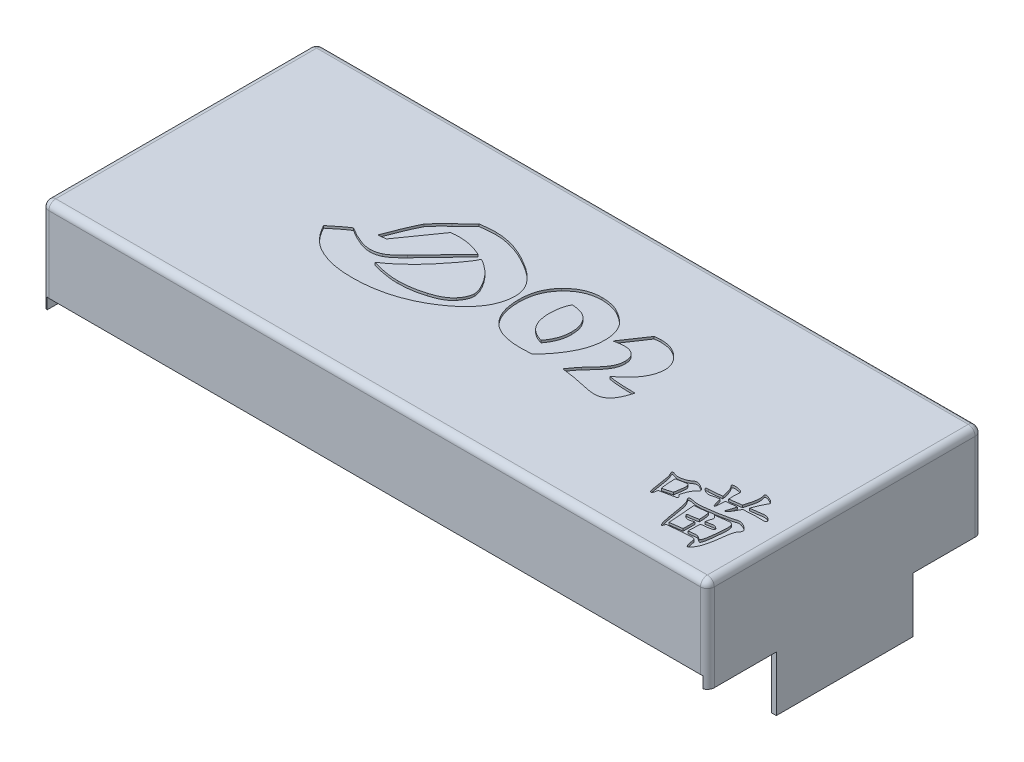
from build123d import *

# Parameters (mm, degrees)
SKETCH1_W               = 289.5
SKETCH1_H               = 119.5
BOSS_EXTRUDE1_DEPTH     = 65
SHELL1_T                = -2
CUT_EXTRUDE1_DEPTH      = 170.551245941
CUT_EXTRUDE1_DEPTH_BACK = 170.551245941
SKETCH2_W               = 285.5
SKETCH2_H               = 29
CUT_EXTRUDE3_DEPTH      = 170.551245941
CUT_EXTRUDE3_DEPTH_BACK = 170.551245941
SKETCH3_W               = 30
SKETCH3_H               = 24
CUT_EXTRUDE4_DEPTH      = 170.551245941
CUT_EXTRUDE5_DEPTH      = 1
CUT_EXTRUDE6_DEPTH      = 1
FILLET1_R               = 3
FILLET2_R               = 3
FILLET3_R               = 3
FILLET4_R               = 3


with BuildPart() as part:
    # Sketch1 → Boss-Extrude1 (new body)
    with BuildSketch(Plane(origin=(0, 0, 0), x_dir=(1, 0, 0), z_dir=(0, 1, 0))):
        Rectangle(SKETCH1_W, SKETCH1_H)
    extrude(amount=BOSS_EXTRUDE1_DEPTH)

    # Shell1
    shell1_openings = [part.faces().sort_by_distance(p)[0] for p in [
        (0, 0, 0),
    ]]
    offset(amount=SHELL1_T, openings=shell1_openings, kind=Kind.INTERSECTION)

    # Sketch2 → Cut-Extrude1 (cut, two sides: drawn at the far end of the back side and taken through both)
    with BuildSketch(Plane.XY.offset(-CUT_EXTRUDE1_DEPTH_BACK)):
        with Locations((0, 14.5)):
            Rectangle(SKETCH2_W, SKETCH2_H)
    extrude(amount=CUT_EXTRUDE1_DEPTH + CUT_EXTRUDE1_DEPTH_BACK, mode=Mode.SUBTRACT)

    # Sketch3 → Cut-Extrude3 (cut, two sides: drawn at the far end of the back side and taken through both)
    with BuildSketch(Plane(origin=(0, 0, 0), x_dir=(0, 0, -1), z_dir=(1, 0, 0)).offset(-CUT_EXTRUDE3_DEPTH_BACK)):
        with Locations((-44.75, 12)):
            Rectangle(SKETCH3_W, SKETCH3_H)
        with Locations((44.75, 12)):
            Rectangle(SKETCH3_W, SKETCH3_H)
    extrude(amount=CUT_EXTRUDE3_DEPTH + CUT_EXTRUDE3_DEPTH_BACK, mode=Mode.SUBTRACT)

    # Sketch4 → Cut-Extrude4 (cut, through all)
    with BuildSketch(Plane(origin=(0, 0, 0), x_dir=(0, 0, -1), z_dir=(1, 0, 0))):
        with BuildLine():
            Line((-5, 0), (5, 0))
            Line((5, 0), (5, 29))
            ThreePointArc((5, 29), (0, 34), (-5, 29))
            Line((-5, 29), (-5, 0))
        make_face()
    extrude(amount=-CUT_EXTRUDE4_DEPTH, mode=Mode.SUBTRACT)

    # Sketch7 → Cut-Extrude5 (cut)
    # profile 1 of 3: a face of its own
    with BuildSketch(Plane(origin=(0, 65, 0), x_dir=(1, 0, 0), z_dir=(0, 1, 0))):
        with BuildLine():
            Line((-54.674937259, 0.016499025), (-58.033506846, -0.321774171))
            add(Edge.make_bspline(
                [(-58.033506846, -0.321774171), (-57.747513462, 0.449210473), (-57.192568901, 1.945237155), (-56.366608965, 4.10798729), (-55.567478005, 6.11560535), (-54.807139042, 7.967661327), (-54.067679057, 9.660579734), (-53.384619826, 11.20871225), (-52.713951937, 12.59378829), (-52.26833461, 13.459636484), (-52.057347053, 13.869591809)],
                knots=[0, 0, 0, 0, 1.280833124, 2.485342015, 3.605857173, 4.646453942, 5.603507755, 6.483249438, 7.281860292, 8, 8, 8, 8], degree=3))
            add(Edge.make_bspline(
                [(-52.057347053, 13.869591809), (-51.654046154, 14.367633044), (-50.838006828, 15.375370036), (-49.728910948, 16.590023376), (-48.769263186, 17.583125645), (-47.965460337, 18.374271528), (-47.093068542, 19.217717275), (-46.479655133, 19.785200008), (-46.161728496, 20.07932119)],
                knots=[0, 0, 0, 0, 1.345467335, 2.722419564, 3.452015842, 4.245305386, 5.090557609, 6, 6, 6, 6], degree=3))
            add(Edge.make_bspline(
                [(-46.161728496, 20.07932119), (-45.811830686, 20.400535547), (-45.138737344, 21.018450946), (-44.185970858, 21.921240372), (-43.310823246, 22.742530058), (-42.527753894, 23.498003261), (-41.841446898, 24.194359353), (-41.22225591, 24.799702931), (-40.708430813, 25.35171183), (-40.394729077, 25.695513703), (-40.250001692, 25.854127891)],
                knots=[0, 0, 0, 0, 1.378904764, 2.65257909, 3.810405872, 4.863177172, 5.81110561, 6.648809811, 7.376623712, 8, 8, 8, 8], degree=3))
            add(Edge.make_bspline(
                [(-40.250001692, 25.854127891), (-39.890290388, 25.900037941), (-39.192663222, 25.989076282), (-38.178524945, 26.114001926), (-37.229533588, 26.204237894), (-36.352687359, 26.298216949), (-35.544424847, 26.364796084), (-34.805432136, 26.398866016), (-34.134645986, 26.4392313), (-33.710107974, 26.441162655), (-33.508700145, 26.442078922)],
                knots=[0, 0, 0, 0, 1.285372494, 2.492862357, 3.621548643, 4.664067405, 5.61871346, 6.495482762, 7.286232232, 8, 8, 8, 8], degree=3))
            add(Edge.make_bspline(
                [(-33.508700145, 26.442078922), (-32.791091018, 26.424787251), (-31.345694816, 26.389958659), (-29.169698963, 26.111394959), (-26.977169338, 25.665810789), (-24.762331238, 25.053949346), (-22.534149204, 24.248643752), (-20.287086942, 23.266599735), (-18.006714026, 22.129691135), (-16.522317377, 21.241134112), (-15.765465609, 20.788084077)],
                knots=[0, 0, 0, 0, 0.912968149, 1.838885047, 2.786969122, 3.758421451, 4.760189679, 5.799163767, 6.877856, 8, 8, 8, 8], degree=3))
            add(Edge.make_bspline(
                [(-15.765465609, 20.788084077), (-15.333769336, 20.533833058), (-14.48753116, 20.035434226), (-13.279570288, 19.243599226), (-12.150271401, 18.441941336), (-11.109233199, 17.617109846), (-10.147933191, 16.782970915), (-9.278677272, 15.925888815), (-8.483776814, 15.063942316), (-7.773718704, 14.184117759), (-7.141284414, 13.291378018), (-6.601322997, 12.376347603), (-6.13716503, 11.450166203), (-5.769070515, 10.504833989), (-5.473450737, 9.54726948), (-5.267957234, 8.574029648), (-5.130413671, 7.585923312), (-5.116730672, 6.922029364), (-5.109859939, 6.588663974)],
                knots=[0, 0, 0, 0, 1.29117103, 2.531034628, 3.721564212, 4.859552596, 5.953167633, 7.000325302, 8.004366033, 8.973757448, 9.912534029, 10.821587791, 11.709753225, 12.579697804, 13.433390691, 14.289799631, 15.141245953, 16, 16, 16, 16], degree=3))
            add(Edge.make_bspline(
                [(-5.109859939, 6.588663974), (-5.117606386, 6.129049388), (-5.133057359, 5.212307362), (-5.30572888, 3.848285785), (-5.55939586, 2.498603343), (-5.924190163, 1.165769406), (-6.393848443, -0.146202492), (-6.957535651, -1.444263984), (-7.640548987, -2.71461505), (-8.414561965, -3.97543053), (-9.293157924, -5.21670425), (-10.28437733, -6.434577881), (-11.368123568, -7.643845433), (-12.566500249, -8.824479082), (-13.85690843, -9.999210392), (-15.261256578, -11.143522562), (-16.75683574, -12.286154284), (-17.813016729, -13.003945132), (-18.350839321, -13.369454583)],
                knots=[0, 0, 0, 0, 0.88254379, 1.760311809, 2.63735212, 3.519488863, 4.411865311, 5.312653943, 6.23561556, 7.180398806, 8.153548558, 9.154832466, 10.19571932, 11.271645537, 12.3853819, 13.547055192, 14.750925126, 16, 16, 16, 16], degree=3))
            add(Edge.make_bspline(
                [(-18.350839321, -13.369454583), (-18.889911308, -13.723700183), (-19.965118561, -14.430261547), (-21.630403862, -15.393225264), (-23.301223693, -16.324012581), (-25.017701392, -17.155335668), (-26.750186604, -17.937710316), (-28.511374818, -18.651125362), (-30.302091587, -19.281360983), (-32.112090984, -19.866550569), (-33.950356935, -20.373208263), (-35.815625704, -20.807965286), (-37.707122987, -21.177068127), (-39.62449456, -21.485846621), (-41.567558103, -21.716803), (-43.536461472, -21.885244916), (-45.53224711, -21.995302643), (-46.873032156, -22.006101032), (-47.547037774, -22.011529325)],
                knots=[0, 0, 0, 0, 1.001564994, 1.997673725, 2.986627611, 3.971177121, 4.958415637, 5.938611922, 6.921084553, 7.906066562, 8.892318491, 9.881421781, 10.879831521, 11.884723522, 12.896803696, 13.917904333, 14.953341416, 16, 16, 16, 16], degree=3))
            add(Edge.make_bspline(
                [(-47.547037774, -22.011529325), (-48.113624292, -22.007790036), (-49.231284714, -22.000413835), (-50.877678403, -21.915248786), (-52.471268864, -21.790713246), (-54.004770709, -21.603429265), (-55.48383969, -21.374211468), (-56.903595907, -21.078922385), (-58.272390256, -20.750656541), (-59.154437802, -20.472823116), (-59.587952723, -20.336271593)],
                knots=[0, 0, 0, 0, 1.113876873, 2.197256828, 3.240546129, 4.256023808, 5.23404382, 6.182295846, 7.106622002, 8, 8, 8, 8], degree=3))
            add(Edge.make_bspline(
                [(-59.587952723, -20.336271593), (-60.011315145, -20.199163015), (-60.841745076, -19.930223066), (-62.035017318, -19.4452845), (-63.174195884, -18.940821244), (-64.252700988, -18.397706369), (-65.261244012, -17.803014931), (-66.217558965, -17.187296563), (-67.103004464, -16.518818826), (-67.652834734, -16.038605831), (-67.923970764, -15.801799944)],
                knots=[0, 0, 0, 0, 1.116558819, 2.1901421, 3.230760133, 4.243292989, 5.218688215, 6.168112262, 7.0966471, 8, 8, 8, 8], degree=3))
            add(Edge.make_bspline(
                [(-67.923970764, -15.801799944), (-68.162523441, -15.586782605), (-68.649312866, -15.148019277), (-69.353520889, -14.426568535), (-70.04090305, -13.628248857), (-70.730597795, -12.761715255), (-71.410031525, -11.82176341), (-72.088468239, -10.812689491), (-72.757956788, -9.732942977), (-73.183327774, -8.978848054), (-73.400774888, -8.593359222)],
                knots=[0, 0, 0, 0, 0.84709784, 1.728583703, 2.657370405, 3.625220998, 4.649476239, 5.716123303, 6.832495838, 8, 8, 8, 8], degree=3))
            add(Edge.make_bspline(
                [(-73.400774888, -8.593359222), (-72.978901127, -8.247502103), (-72.170505248, -7.58476956), (-71.016222893, -6.626186257), (-69.939676232, -5.788490286), (-68.978431401, -5.022958057), (-68.099274573, -4.372472493), (-67.319216278, -3.818766327), (-66.642917592, -3.350281634), (-66.212323803, -3.090528669), (-66.015143444, -2.971580872)],
                knots=[0, 0, 0, 0, 1.409436766, 2.700767341, 3.876124895, 4.933438545, 5.875387055, 6.701060049, 7.405180815, 8, 8, 8, 8], degree=3))
            add(Edge.make_bspline(
                [(-66.015143444, -2.971580872), (-65.43284187, -3.325714975), (-64.307482491, -4.010116585), (-62.631305819, -4.917243563), (-61.04537923, -5.700181203), (-59.537469284, -6.327519278), (-58.117871853, -6.830130817), (-56.778267635, -7.17545883), (-55.522865687, -7.401773427), (-54.710685854, -7.434130809), (-54.320555815, -7.449673655)],
                knots=[0, 0, 0, 0, 1.291298086, 2.495570122, 3.610471241, 4.641272912, 5.588924353, 6.461319531, 7.260895866, 8, 8, 8, 8], degree=3))
            add(Edge.make_bspline(
                [(-54.320555815, -7.449673655), (-53.954536521, -7.437299413), (-53.217483735, -7.412381409), (-52.113614924, -7.206144994), (-51.00621516, -6.890668703), (-50.293019175, -6.577622722), (-49.931058393, -6.41874582)],
                knots=[0, 0, 0, 0, 0.965975582, 1.945184323, 2.957141225, 4, 4, 4, 4], degree=3))
            add(Edge.make_bspline(
                [(-49.931058393, -6.41874582), (-49.735844474, -6.32009323), (-49.321782833, -6.110844556), (-48.701493571, -5.703913613), (-48.022315271, -5.22042972), (-47.294495383, -4.641673441), (-46.520861758, -3.969523209), (-45.699996412, -3.208304886), (-44.819189716, -2.365120395), (-44.229438356, -1.757400081), (-43.922682104, -1.441297367)],
                knots=[0, 0, 0, 0, 0.669398079, 1.419837625, 2.268608205, 3.222713685, 4.266168329, 5.406669527, 6.651091983, 8, 8, 8, 8], degree=3))
            add(Edge.make_bspline(
                [(-43.922682104, -1.441297367), (-43.753678156, -1.266662837), (-43.397189743, -0.89829756), (-42.830594611, -0.318432161), (-42.213686716, 0.326362703), (-41.5339295, 1.026664466), (-40.803997937, 1.791999518), (-40.011784986, 2.615991653), (-39.15838565, 3.499687764), (-38.25098197, 4.447428678), (-37.289776436, 5.45936207), (-36.269422447, 6.527721455), (-35.18744378, 7.655379125), (-34.05501605, 8.847762597), (-32.859703985, 10.095688918), (-31.612077721, 11.411795327), (-30.301279519, 12.783181674), (-29.411509118, 13.721621935), (-28.958120248, 14.199810881)],
                knots=[0, 0, 0, 0, 0.538878973, 1.136684156, 1.797692869, 2.5176244, 3.300768368, 4.142832361, 5.052235536, 6.024852748, 7.052275906, 8.147031612, 9.300705128, 10.517601121, 11.793413326, 13.132450907, 14.538819856, 16, 16, 16, 16], degree=3))
            add(Edge.make_bspline(
                [(-28.958120248, 14.199810881), (-29.393967221, 14.394553366), (-30.257329253, 14.780315523), (-31.573300011, 15.282190878), (-32.892968661, 15.696465274), (-34.210680002, 16.049890676), (-35.535038576, 16.312678082), (-36.859915522, 16.507746634), (-38.188787449, 16.622982665), (-39.073884533, 16.639829051), (-39.517076434, 16.648264489)],
                knots=[0, 0, 0, 0, 1.048530823, 2.077017297, 3.091663908, 4.08584548, 5.072423895, 6.055753608, 7.026463571, 8, 8, 8, 8], degree=3))
            add(Edge.make_bspline(
                [(-39.517076434, 16.648264489), (-39.766817882, 16.647786981), (-40.298828672, 16.646769771), (-41.141519558, 16.597482315), (-42.079358563, 16.547665907), (-42.733525744, 16.486880937), (-43.076999114, 16.45496552)],
                knots=[0, 0, 0, 0, 0.840143385, 1.789712318, 2.839478681, 4, 4, 4, 4], degree=3))
            add(Edge.make_bspline(
                [(-43.076999114, 16.45496552), (-43.112257271, 16.412287547), (-43.213532805, 16.28969933), (-43.3952682, 16.035197032), (-43.668813506, 15.669244974), (-44.02673686, 15.183121115), (-44.455957163, 14.57228368), (-44.976162718, 13.84351089), (-45.576944995, 12.996605112), (-46.252638304, 12.021149456), (-47.030175005, 10.942584931), (-47.869176019, 9.728658262), (-48.811482492, 8.409952014), (-49.818910394, 6.960383104), (-50.921130573, 5.397310875), (-52.089966611, 3.70450471), (-53.359099943, 1.902810396), (-54.22709703, 0.65849793), (-54.674937259, 0.016499025)],
                knots=[0, 0, 0, 0, 0.132047228, 0.379292478, 0.745680671, 1.222257434, 1.819422896, 2.526787836, 3.358506575, 4.296736332, 5.357783742, 6.530570938, 7.817241471, 9.224586106, 10.742125874, 12.380363193, 14.132460352, 16, 16, 16, 16], degree=3))
        make_face()
        with BuildLine():
            add(Edge.make_bspline(
                [(-48.416883135, -11.267328294), (-47.878244243, -11.426573626), (-46.818793538, -11.73979382), (-45.236368656, -12.142044335), (-43.689445329, -12.482460098), (-42.176145217, -12.754398812), (-40.698943959, -12.972734093), (-39.257161694, -13.139370242), (-37.845606501, -13.22665756), (-36.915695166, -13.241375218), (-36.456509424, -13.248642727)],
                knots=[0, 0, 0, 0, 1.107941863, 2.179214694, 3.220104169, 4.23191643, 5.211588704, 6.165483813, 7.094124734, 8, 8, 8, 8], degree=3))
            add(Edge.make_bspline(
                [(-36.456509424, -13.248642727), (-35.534539888, -13.230045538), (-33.676702079, -13.192570806), (-30.885376889, -12.835253483), (-28.063913126, -12.323623092), (-26.20790434, -11.793261167), (-25.269331589, -11.525060253)],
                knots=[0, 0, 0, 0, 0.973595114, 1.961867225, 2.969328216, 4, 4, 4, 4], degree=3))
            add(Edge.make_bspline(
                [(-25.269331589, -11.525060253), (-24.813805662, -11.382634711), (-23.929881281, -11.106265349), (-22.674138666, -10.618371991), (-21.51242606, -10.107696998), (-20.464453309, -9.543090628), (-19.506535543, -8.956591173), (-18.664491014, -8.315314301), (-17.902351648, -7.656214388), (-17.47811982, -7.159783814), (-17.271586743, -6.91810149)],
                knots=[0, 0, 0, 0, 1.223283248, 2.373717554, 3.45207125, 4.474404087, 5.423613715, 6.32804501, 7.186025221, 8, 8, 8, 8], degree=3))
            add(Edge.make_bspline(
                [(-17.271586743, -6.91810149), (-17.083663061, -6.67849858), (-16.719246472, -6.213867013), (-16.233876263, -5.505949466), (-15.826958075, -4.804930691), (-15.488697983, -4.120285254), (-15.227131778, -3.443715393), (-15.038371978, -2.783995452), (-14.931763439, -2.132014762), (-14.912963414, -1.702061082), (-14.903674372, -1.489622109)],
                knots=[0, 0, 0, 0, 1.210590801, 2.347545365, 3.409460581, 4.43112375, 5.380701617, 6.289816649, 7.155002944, 8, 8, 8, 8], degree=3))
            add(Edge.make_bspline(
                [(-14.903674372, -1.489622109), (-14.913768208, -1.25270003), (-14.934926984, -0.756062184), (-15.092453548, 0.009023507), (-15.326983716, 0.828359945), (-15.660986329, 1.697380479), (-16.090883954, 2.616512256), (-16.61957865, 3.584772176), (-17.241022361, 4.606554355), (-17.701202747, 5.296328778), (-17.940079011, 5.654385623)],
                knots=[0, 0, 0, 0, 0.722601917, 1.514723581, 2.375584877, 3.321971516, 4.351898795, 5.46993908, 6.686663928, 8, 8, 8, 8], degree=3))
            add(Edge.make_bspline(
                [(-17.940079011, 5.654385623), (-18.204616507, 6.019792324), (-18.735275388, 6.752793559), (-19.604636592, 7.801085664), (-20.554628627, 8.793401092), (-21.565240343, 9.743563682), (-22.652654754, 10.640185671), (-23.803379101, 11.49199313), (-25.02110898, 12.303568612), (-25.875781007, 12.792552189), (-26.308313547, 13.040017066)],
                knots=[0, 0, 0, 0, 0.961333478, 1.928422835, 2.899802505, 3.887593865, 4.883259486, 5.901813225, 6.938149341, 8, 8, 8, 8], degree=3))
            add(Edge.make_bspline(
                [(-26.308313547, 13.040017066), (-26.387396593, 12.872826154), (-26.552255889, 12.524294102), (-26.841601188, 11.990991213), (-27.158533472, 11.407477238), (-27.542024043, 10.793085875), (-27.957179746, 10.132945216), (-28.421706605, 9.436547345), (-28.926612103, 8.696400613), (-29.676548981, 7.64787073), (-30.676907677, 6.282910088), (-31.972080511, 4.621755422), (-33.335857577, 2.891854674), (-34.297812266, 1.740430212), (-34.789305815, 1.152130468)],
                knots=[0, 0, 0, 0, 0.454872032, 0.948242222, 1.492193265, 2.087959296, 2.729208267, 3.410588809, 4.146973686, 4.933117171, 6.581576909, 8.309404673, 10.1143563, 12, 12, 12, 12], degree=3))
            add(Edge.make_bspline(
                [(-34.789305815, 1.152130468), (-35.250057639, 0.606592854), (-36.187794712, -0.503703015), (-37.693326946, -2.141542107), (-39.311492271, -3.786779437), (-41.018072674, -5.435372017), (-42.799505215, -7.034000224), (-44.627599842, -8.552158103), (-46.496379294, -9.964863273), (-47.779516885, -10.835073368), (-48.416883135, -11.267328294)],
                knots=[0, 0, 0, 0, 0.926221979, 1.885077049, 2.884930053, 3.919398158, 4.962605073, 5.989075526, 7.001123964, 8, 8, 8, 8], degree=3))
        make_face(mode=Mode.SUBTRACT)
    # profile 2 of 3: a face of its own
    with BuildSketch(Plane(origin=(0, 65, 0), x_dir=(1, 0, 0), z_dir=(0, 1, 0))):
        with BuildLine():
            add(Edge.make_bspline(
                [(20.445874597, -11.678088604), (20.145200215, -11.691784528), (19.568079692, -11.718072763), (18.73584401, -11.751632035), (17.975856912, -11.772099562), (17.288787145, -11.800395914), (16.676483529, -11.812935798), (16.137010873, -11.831843431), (15.669808915, -11.840582103), (15.382517543, -11.83961426), (15.250964803, -11.839171078)],
                knots=[0, 0, 0, 0, 1.38976758, 2.667548158, 3.845782986, 4.900123914, 5.842568302, 6.673489852, 7.39258167, 8, 8, 8, 8], degree=3))
            add(Edge.make_bspline(
                [(15.250964803, -11.839171078), (14.493373087, -11.825934825), (13.025880976, -11.800295557), (10.899928484, -11.584141521), (8.931178162, -11.21444571), (7.112094579, -10.713223571), (5.452033975, -10.053447914), (3.950182462, -9.242159982), (2.591976146, -8.294907684), (1.815202332, -7.535987456), (1.430088514, -7.159725202)],
                knots=[0, 0, 0, 0, 1.211870576, 2.347452425, 3.41394946, 4.413409066, 5.361759666, 6.265034661, 7.139827948, 8, 8, 8, 8], degree=3))
            add(Edge.make_bspline(
                [(1.430088514, -7.159725202), (1.070699941, -6.759894196), (0.347507419, -5.955319942), (-0.556233177, -4.58605858), (-1.336444986, -3.106964282), (-1.961415262, -1.499922839), (-2.455159554, 0.222369511), (-2.794116114, 2.067546931), (-3.008119609, 4.033151014), (-3.034451933, 5.385332926), (-3.048004269, 6.08125418)],
                knots=[0, 0, 0, 0, 0.899394148, 1.809838066, 2.739099067, 3.696050547, 4.692361407, 5.735693675, 6.834639863, 8, 8, 8, 8], degree=3))
            add(Edge.make_bspline(
                [(-3.048004269, 6.08125418), (-3.03346585, 6.747888828), (-3.004934367, 8.056151844), (-2.753124217, 9.971429462), (-2.368445567, 11.80065927), (-1.797969045, 13.530384993), (-1.079828396, 15.170493896), (-0.196964661, 16.71412352), (0.843994717, 18.170700635), (1.656525908, 19.048573586), (2.066364288, 19.491370159)],
                knots=[0, 0, 0, 0, 1.085421029, 2.13012659, 3.141420271, 4.126067407, 5.09138384, 6.053097759, 7.017988149, 8, 8, 8, 8], degree=3))
            add(Edge.make_bspline(
                [(2.066364288, 19.491370159), (2.490810413, 19.921231626), (3.325880558, 20.766956102), (4.69300056, 21.872728815), (6.127633579, 22.809831499), (7.633023029, 23.564361663), (9.196526749, 24.173901319), (10.834281643, 24.583225457), (12.532945854, 24.855888938), (13.690059941, 24.882302409), (14.276415834, 24.895687169)],
                knots=[0, 0, 0, 0, 1.053382021, 2.07246061, 3.061202137, 4.03741458, 5.005648873, 5.982715062, 6.977761203, 8, 8, 8, 8], degree=3))
            add(Edge.make_bspline(
                [(14.276415834, 24.895687169), (14.690113822, 24.890452737), (15.505463159, 24.880136296), (16.704598663, 24.770230766), (17.86486174, 24.604554198), (18.980571407, 24.361247028), (20.056925773, 24.059568368), (21.083783298, 23.672649004), (22.078282627, 23.239320357), (22.703924897, 22.882473134), (23.015140061, 22.70496552)],
                knots=[0, 0, 0, 0, 1.088524132, 2.145351092, 3.166620004, 4.171402837, 5.14878054, 6.105637182, 7.057681263, 8, 8, 8, 8], degree=3))
            add(Edge.make_bspline(
                [(23.015140061, 22.70496552), (23.336571175, 22.514772398), (23.966304719, 22.142154494), (24.860637419, 21.540726633), (25.7016576, 20.935428525), (26.466408657, 20.295150365), (27.169527743, 19.643153863), (27.80964074, 18.973004281), (28.384037222, 18.281774335), (28.720759399, 17.797089461), (28.886596246, 17.558380468)],
                knots=[0, 0, 0, 0, 1.137649211, 2.228831737, 3.28242594, 4.293043015, 5.265331369, 6.202583347, 7.114766023, 8, 8, 8, 8], degree=3))
            add(Edge.make_bspline(
                [(28.886596246, 17.558380468), (29.05650334, 17.287901812), (29.400353378, 16.740519741), (29.808655445, 15.845021895), (30.180206728, 14.902324896), (30.460889938, 13.890617484), (30.700571096, 12.827557359), (30.856171189, 11.701394713), (30.955312312, 10.518199629), (30.966763882, 9.708507149), (30.972614288, 9.294849541)],
                knots=[0, 0, 0, 0, 0.886039969, 1.793126302, 2.727676125, 3.697453612, 4.705008985, 5.751953224, 6.851512547, 8, 8, 8, 8], degree=3))
            add(Edge.make_bspline(
                [(30.972614288, 9.294849541), (30.964678931, 8.873090499), (30.948776121, 8.027866541), (30.825023885, 6.757431042), (30.612962048, 5.483238443), (30.32226561, 4.200512469), (29.950170016, 2.910104974), (29.498809243, 1.614100657), (28.966001324, 0.311735688), (28.339892978, -0.993568818), (27.642445945, -2.312414376), (26.859544199, -3.634296402), (25.991208988, -4.957695506), (25.05079461, -6.296639301), (24.019724663, -7.638529044), (22.904313521, -8.984193476), (21.713255174, -10.33940167), (20.872926014, -11.227010086), (20.445874597, -11.678088604)],
                knots=[0, 0, 0, 0, 0.841784231, 1.686973201, 2.545077378, 3.418720343, 4.310887603, 5.224383061, 6.156858553, 7.118087377, 8.112966109, 9.134056587, 10.183442855, 11.271788038, 12.399376132, 13.560343902, 14.760177985, 16, 16, 16, 16], degree=3))
        make_face()
        with BuildLine():
            add(Edge.make_bspline(
                [(10.595681298, 15.617336654), (10.451248199, 15.351224503), (10.156887238, 14.808876323), (9.797273221, 13.930957662), (9.493360647, 12.990597011), (9.244387279, 11.980832697), (9.041276956, 10.908649992), (8.911720151, 9.764392624), (8.815899125, 8.558183233), (8.81045513, 7.729874794), (8.807665834, 7.305480984)],
                knots=[0, 0, 0, 0, 0.844831347, 1.721803168, 2.643869773, 3.601914824, 4.623640527, 5.688157834, 6.815499807, 8, 8, 8, 8], degree=3))
            add(Edge.make_bspline(
                [(8.807665834, 7.305480984), (8.813350584, 6.915958097), (8.824424956, 6.157134618), (8.925218362, 5.046472886), (9.078629221, 3.992259285), (9.319544062, 2.996285895), (9.603149865, 2.053837782), (9.958693123, 1.168190866), (10.387336539, 0.344243679), (10.881215563, -0.421538163), (11.429571789, -1.139227745), (12.054369756, -1.790699735), (12.738643127, -2.391058599), (13.497153038, -2.921031752), (14.308497208, -3.409556133), (15.195205233, -3.822557942), (16.135574809, -4.201226008), (16.79803131, -4.389704481), (17.135629752, -4.48575613)],
                knots=[0, 0, 0, 0, 1.188005534, 2.314335106, 3.399660332, 4.434654097, 5.437221659, 6.399924281, 7.341349857, 8.265988911, 9.176814061, 10.092120452, 11.015125834, 11.949112022, 12.91125708, 13.900353187, 14.929986358, 16, 16, 16, 16], degree=3))
            add(Edge.make_bspline(
                [(17.135629752, -4.48575613), (17.41855663, -4.106250186), (17.975990791, -3.358531985), (18.688373678, -2.179719063), (19.296404815, -0.989990145), (19.801920195, 0.208001021), (20.177618586, 1.429708936), (20.465981312, 2.657864648), (20.628281349, 3.907662824), (20.651629492, 4.743837377), (20.663335937, 5.163084077)],
                knots=[0, 0, 0, 0, 1.085155259, 2.138017475, 3.154174569, 4.14790209, 5.115807064, 6.082241965, 7.038461857, 8, 8, 8, 8], degree=3))
            add(Edge.make_bspline(
                [(20.663335937, 5.163084077), (20.658232621, 5.469250998), (20.648283018, 6.066164803), (20.584301391, 6.940305614), (20.474205644, 7.769435436), (20.309917601, 8.553786746), (20.112366622, 9.298568967), (19.860537149, 9.996926987), (19.57601998, 10.656227988), (19.338556684, 11.060850389), (19.221647793, 11.260055726)],
                knots=[0, 0, 0, 0, 1.158325379, 2.258311923, 3.314126806, 4.320103133, 5.28845556, 6.226557231, 7.126891478, 8, 8, 8, 8], degree=3))
            add(Edge.make_bspline(
                [(19.221647793, 11.260055726), (18.976702245, 11.632854513), (18.502916146, 12.353940831), (17.647401673, 13.279006847), (16.715196973, 14.036023133), (16.020525288, 14.388409155), (15.67783336, 14.562246448)],
                knots=[0, 0, 0, 0, 1.087279757, 2.103071642, 3.064216879, 4, 4, 4, 4], degree=3))
            add(Edge.make_bspline(
                [(15.67783336, 14.562246448), (15.294391535, 14.716846503), (14.514868345, 15.031142754), (13.266602356, 15.328393792), (11.956085517, 15.548933748), (11.055722086, 15.5942052), (10.595681298, 15.617336654)],
                knots=[0, 0, 0, 0, 0.949117954, 1.92952205, 2.942089078, 4, 4, 4, 4], degree=3))
        make_face(mode=Mode.SUBTRACT)
    # profile 3 of 3: a face of its own
    with BuildSketch(Plane(origin=(0, 65, 0), x_dir=(1, 0, 0), z_dir=(0, 1, 0))):
        with BuildLine():
            Line((33.042524081, 10.857349541), (40.259018927, 21.537117582))
            add(Edge.make_bspline(
                [(40.259018927, 21.537117582), (40.535468826, 21.575193812), (41.058337731, 21.647210032), (41.80366901, 21.742219506), (42.470532229, 21.791274381), (42.889972681, 21.799199511), (43.08601635, 21.802903664)],
                knots=[0, 0, 0, 0, 1.178383744, 2.228759059, 3.172133805, 4, 4, 4, 4], degree=3))
            add(Edge.make_bspline(
                [(43.08601635, 21.802903664), (43.502617857, 21.794230273), (44.319637919, 21.777220409), (45.517867983, 21.625449902), (46.666524371, 21.394806903), (47.764992377, 21.069191529), (48.801939168, 20.626170093), (49.787241893, 20.099827118), (50.733245607, 19.492450128), (51.303807169, 19.004301418), (51.591170989, 18.758444901)],
                knots=[0, 0, 0, 0, 1.081191072, 2.120383105, 3.130582158, 4.120670419, 5.089002386, 6.052530951, 7.019155542, 8, 8, 8, 8], degree=3))
            add(Edge.make_bspline(
                [(51.591170989, 18.758444901), (51.878135413, 18.489594439), (52.43747861, 17.96555848), (53.172184838, 17.114611509), (53.798150769, 16.242716399), (54.309529611, 15.344218962), (54.710356526, 14.418618469), (54.989934455, 13.466359017), (55.16825094, 12.488258042), (55.188962641, 11.827295364), (55.199418411, 11.493625314)],
                knots=[0, 0, 0, 0, 1.127361027, 2.197421238, 3.218906291, 4.201836329, 5.157445083, 6.105326584, 7.043522736, 8, 8, 8, 8], degree=3))
            add(Edge.make_bspline(
                [(55.199418411, 11.493625314), (55.189928964, 11.173967784), (55.170902028, 10.533034423), (55.070908017, 9.572141583), (54.869401472, 8.621788672), (54.612190402, 7.673938475), (54.285241285, 6.731574253), (53.866663622, 5.801648525), (53.38423326, 4.875588811), (52.827646508, 3.953422743), (52.185160117, 3.04458022), (51.480966144, 2.134152354), (50.691761914, 1.23960263), (49.839951798, 0.344855653), (48.908288055, -0.542709349), (47.905743626, -1.426818278), (46.821182586, -2.297252205), (46.065114518, -2.861134981), (45.679444185, -3.148771593)],
                knots=[0, 0, 0, 0, 0.846135376, 1.696554406, 2.55200292, 3.413711649, 4.294449799, 5.188157408, 6.109640586, 7.056301992, 8.035794083, 9.053270764, 10.100495129, 11.190855016, 12.321391551, 13.50428507, 14.726935773, 16, 16, 16, 16], degree=3))
            add(Edge.make_bspline(
                [(45.679444185, -3.148771593), (45.955421047, -3.20814628), (46.565935117, -3.339494545), (47.580760489, -3.482828465), (48.778034814, -3.622490069), (50.162021415, -3.728665161), (51.732753405, -3.824676941), (53.488669603, -3.905887621), (55.430078756, -3.959020712), (56.786057534, -3.982290953), (57.494843669, -3.994454583)],
                knots=[0, 0, 0, 0, 0.570975867, 1.263108792, 2.072287824, 3.009631731, 4.070818936, 5.256176973, 6.565771271, 8, 8, 8, 8], degree=3))
            Line((57.494843669, -3.994454583), (56.5202947, -6.901993243))
            add(Edge.make_bspline(
                [(56.5202947, -6.901993243), (56.405936475, -7.190905497), (56.184145096, -7.751234645), (55.798073178, -8.542490007), (55.410046668, -9.274940925), (54.994358825, -9.941217066), (54.565232768, -10.547070503), (54.101857933, -11.078498033), (53.628989334, -11.552059515), (53.287916424, -11.820779164), (53.121454494, -11.95192881)],
                knots=[0, 0, 0, 0, 1.209024934, 2.3448362, 3.424907327, 4.434045164, 5.399830109, 6.311160134, 7.175755286, 8, 8, 8, 8], degree=3))
            add(Edge.make_bspline(
                [(53.121454494, -11.95192881), (52.813052956, -12.150491021), (52.195082457, -12.54836708), (51.158258605, -12.95570494), (50.048640959, -13.205129669), (49.283682527, -13.233933442), (48.893039545, -13.248642727)],
                knots=[0, 0, 0, 0, 0.977685923, 1.959072779, 2.957755271, 4, 4, 4, 4], degree=3))
            add(Edge.make_bspline(
                [(48.893039545, -13.248642727), (48.756096545, -13.243869911), (48.457810524, -13.233473874), (47.973680328, -13.202784935), (47.420069273, -13.13739111), (46.796405168, -13.033147817), (46.098774851, -12.928184696), (45.329915646, -12.775931038), (44.488862628, -12.610451692), (43.904658863, -12.48445518), (43.601480267, -12.419067985)],
                knots=[0, 0, 0, 0, 0.61310789, 1.335457182, 2.169871408, 3.105998214, 4.164529677, 5.326020067, 6.612310411, 8, 8, 8, 8], degree=3))
            add(Edge.make_bspline(
                [(43.601480267, -12.419067985), (43.070166477, -12.299788615), (42.027673554, -12.065750083), (40.49532163, -11.742225638), (39.024758376, -11.465018582), (37.622852996, -11.199578087), (36.279041877, -10.98674012), (35.001845865, -10.797335562), (33.787156496, -10.654383845), (32.999664581, -10.573731828), (32.615655525, -10.534403037)],
                knots=[0, 0, 0, 0, 1.171656753, 2.298912423, 3.369507655, 4.391483015, 5.368693, 6.296723519, 7.16942183, 8, 8, 8, 8], degree=3))
            add(Edge.make_bspline(
                [(32.615655525, -10.534403037), (32.822741716, -10.239343518), (33.218088081, -9.676048074), (33.775589045, -8.869617712), (34.295742688, -8.15873534), (34.758288876, -7.536436983), (35.164762388, -6.998216031), (35.51604157, -6.547221952), (35.819885362, -6.184650533), (36.011151677, -5.977865238), (36.095036968, -5.887173655)],
                knots=[0, 0, 0, 0, 1.489268318, 2.843148608, 4.050025529, 5.128120633, 6.046500884, 6.836409323, 7.489674158, 8, 8, 8, 8], degree=3))
            add(Edge.make_bspline(
                [(36.095036968, -5.887173655), (36.439459322, -5.533555631), (37.103231554, -4.852061463), (38.05154999, -3.853197083), (38.900776061, -2.903700024), (39.668178235, -2.019343612), (40.342444647, -1.198279016), (40.928990662, -0.459285978), (41.411744426, 0.208016408), (41.686187825, 0.632913521), (41.813464803, 0.82996552)],
                knots=[0, 0, 0, 0, 1.340805125, 2.584005365, 3.740680074, 4.800554176, 5.764112574, 6.626253854, 7.362905945, 8, 8, 8, 8], degree=3))
            add(Edge.make_bspline(
                [(41.813464803, 0.82996552), (42.047795189, 1.235012581), (42.508393589, 2.031170654), (42.99332344, 3.308837791), (43.286309345, 4.62084224), (43.324575898, 5.507934752), (43.343748308, 5.9523882)],
                knots=[0, 0, 0, 0, 1.035576096, 2.035522161, 3.01575209, 4, 4, 4, 4], degree=3))
            add(Edge.make_bspline(
                [(43.343748308, 5.9523882), (43.326450957, 6.359677811), (43.293338532, 7.139354776), (43.006215831, 8.244567689), (42.524190386, 9.223110188), (42.049381076, 9.749915345), (41.813464803, 10.011666551)],
                knots=[0, 0, 0, 0, 1.095512209, 2.097145645, 3.054537687, 4, 4, 4, 4], degree=3))
            add(Edge.make_bspline(
                [(41.813464803, 10.011666551), (41.681553535, 10.129894644), (41.415923498, 10.367970837), (40.972553893, 10.676001302), (40.481555805, 10.923292496), (39.957489782, 11.136087648), (39.386636651, 11.293939114), (38.779051554, 11.417525912), (38.12856999, 11.47786554), (37.684476479, 11.48827446), (37.456183875, 11.493625314)],
                knots=[0, 0, 0, 0, 0.900209006, 1.812753034, 2.734642146, 3.690274843, 4.684046451, 5.741497964, 6.83898481, 8, 8, 8, 8], degree=3))
            add(Edge.make_bspline(
                [(37.456183875, 11.493625314), (37.163201387, 11.484777854), (36.526842281, 11.465561138), (35.498600151, 11.32880028), (34.316907284, 11.142871743), (33.484549107, 10.956384084), (33.042524081, 10.857349541)],
                knots=[0, 0, 0, 0, 0.786957638, 1.70927506, 2.783507177, 4, 4, 4, 4], degree=3))
        make_face()
    extrude(amount=-CUT_EXTRUDE5_DEPTH, mode=Mode.SUBTRACT)

    # Sketch6 → Cut-Extrude6 (cut)
    # profile 1 of 3: a face of its own
    with BuildSketch(Plane(origin=(0, 65, 0), x_dir=(1, 0, 0), z_dir=(0, 1, 0))):
        with BuildLine():
            add(Edge.make_bspline(
                [(113.738519479, -46.658187112), (113.697764889, -46.806392469), (113.623900313, -47.075003334), (113.489202061, -47.427633811), (113.375657242, -47.705741928), (113.249153547, -47.889801443), (113.135173358, -48.019293539), (112.988606059, -48.036010797), (112.856783839, -47.952553498), (112.709379192, -47.702552439), (112.520261928, -47.261804219), (112.290368225, -46.582097275), (112.049121551, -45.71794607), (111.838836944, -44.880863752), (111.673197258, -44.10961342), (111.538504509, -43.448656507), (111.391046794, -42.729003213), (111.261933986, -41.944569981), (111.105339852, -41.104361714), (110.968340154, -40.199426958), (110.817475209, -39.238001378), (110.664577871, -38.241563805), (110.521101942, -37.261906176), (110.35053545, -36.354126937), (110.170804506, -35.54077956), (109.977936884, -34.823061906), (109.777774713, -34.1990863), (109.566836489, -33.671471491), (109.342838894, -33.238165257), (109.10450434, -32.901980674), (108.876157995, -32.642939212), (108.723179871, -32.401332452), (108.614030035, -32.198940624), (108.552687955, -32.027626869), (108.554335569, -31.879198332), (108.620105126, -31.758428096), (108.751501566, -31.688315874), (109.00082165, -31.642003467), (109.390439519, -31.634458826), (109.934978359, -31.679292228), (110.578152764, -31.769101841), (111.173418703, -31.900280935), (111.712775174, -32.009102679), (112.178294536, -32.055079642), (112.68969769, -32.088117986), (113.246880724, -32.101688449), (113.851487163, -32.085781685), (114.503538183, -32.052468816), (115.201621155, -32.002850004), (116.206544229, -31.891183442), (117.531873412, -31.731101251), (119.180597095, -31.477035953), (120.911241782, -31.203451379), (122.377072577, -30.927667076), (123.535962014, -30.707189377), (124.328737196, -30.544672153), (125.037441949, -30.390240901), (125.66040077, -30.23921585), (126.200975275, -30.1051085), (126.654733471, -29.977816117), (127.022742804, -29.85388842), (127.403607647, -29.702417962), (127.847797266, -29.533673563), (128.42861676, -29.496337187), (129.056225622, -29.54744761), (129.719754382, -29.724988955), (130.404591972, -29.979249472), (131.077852683, -30.335014019), (131.727040491, -30.780186434), (132.238411101, -31.208054082), (132.605536098, -31.576633206), (132.805983987, -31.864271163), (132.928204562, -32.154672749), (132.985796728, -32.445558484), (132.957575162, -32.742572254), (132.84595882, -33.033148825), (132.667967941, -33.324742005), (132.398356311, -33.604578008), (132.112923319, -33.969988417), (131.859115642, -34.478668182), (131.615969172, -35.12325499), (131.393778854, -35.911211445), (131.188068761, -36.840305781), (130.997485783, -37.909544519), (130.812580544, -39.122313175), (130.66542279, -40.440154838), (130.50889399, -41.783799759), (130.306948412, -43.068944637), (130.077475362, -44.262810787), (129.800965257, -45.360138922), (129.508815425, -46.372320614), (129.168891479, -47.286057557), (128.809816584, -48.113978537), (128.410339968, -48.827604463), (128.0218843, -49.427520714), (127.660377571, -49.892408014), (127.340025477, -50.225449296), (127.040733667, -50.418001019), (126.745546007, -50.463430013), (126.488880468, -50.316489828), (126.315269786, -50.019744284), (126.139321655, -49.484389356), (125.969689314, -48.778142202), (125.785598917, -47.995138102), (125.646086241, -47.332513302), (125.591980808, -46.853696397), (125.547055801, -46.520699871), (125.432706091, -46.320986287), (125.28136281, -46.146021591), (125.070324051, -46.006744736), (124.807356546, -45.908980456), (124.49637916, -45.828634007), (124.133854954, -45.786427072), (123.875060742, -45.782870563), (123.738519479, -45.780994129)],
                knots=[0, 0, 0, 0, 0.732739981, 1.328035117, 1.804580801, 2.154387254, 2.403352697, 2.590576902, 2.803443736, 3.107485419, 3.958764469, 5.096478212, 6.526414242, 8.241386813, 9.214671627, 10.291235623, 11.461044371, 12.720423976, 14.085199761, 15.540030594, 17.088379214, 18.730256372, 20.351698504, 21.813564273, 23.137802531, 24.326461375, 25.359510214, 26.263692076, 27.035983274, 27.681325787, 28.225408538, 28.681324583, 29.04196165, 29.323178237, 29.540516508, 29.730291955, 29.948366552, 30.224211523, 30.938188591, 31.798458955, 32.832076612, 34.034323634, 34.707467669, 35.456364489, 36.26436221, 37.153647141, 38.115278075, 39.150342218, 40.269875611, 41.454887632, 43.975767403, 46.640997113, 49.416325552, 52.338174048, 53.759414187, 55.046824463, 56.20062784, 57.221134856, 58.106203716, 58.858801626, 59.470127658, 59.957757281, 60.817530595, 61.720707252, 62.706267379, 63.814479465, 64.985703369, 66.187950391, 67.438088985, 68.736575028, 69.365394433, 69.91592088, 70.397818672, 70.860135893, 71.316871615, 71.8008716, 72.334542694, 72.935555082, 73.650952703, 74.538794379, 75.635032255, 76.937175608, 78.441945369, 80.175634949, 82.120117219, 84.296104462, 86.504122992, 88.575928384, 90.503990748, 92.304210316, 93.975632538, 95.5292179, 96.954625192, 98.278015809, 99.42778303, 100.36259028, 101.086305031, 101.623568566, 102.039140062, 102.436840374, 102.950095783, 103.643417492, 105.127772591, 106.411691691, 107.486218762, 108.351752662, 108.720738576, 109.072221305, 109.431075971, 109.818154498, 110.263517422, 110.764977122, 111.348395078, 112, 112, 112, 112], degree=3))
            add(Edge.make_bspline(
                [(123.738519479, -45.780994129), (123.664888447, -45.783433244), (123.498150899, -45.788956621), (123.220571413, -45.791152792), (122.889659594, -45.816959429), (122.50357049, -45.830966198), (122.066369154, -45.866990989), (121.574700562, -45.905596693), (121.031042334, -45.951058625), (120.431128884, -46.003526305), (119.779117637, -46.061233977), (119.073116737, -46.127161036), (118.31500722, -46.198198364), (117.502788497, -46.276169721), (116.638653218, -46.361251169), (115.719858527, -46.450060682), (114.748222665, -46.557976668), (114.080803975, -46.624216256), (113.738519479, -46.658187112)],
                knots=[0, 0, 0, 0, 0.352212237, 0.797584971, 1.326587825, 1.938304719, 2.644325582, 3.423409678, 4.296219857, 5.252447639, 6.302416843, 7.425508676, 8.642351824, 9.942640672, 11.326379638, 12.793572383, 14.355589268, 16, 16, 16, 16], degree=3))
        make_face()
        with BuildLine():
            add(Edge.make_bspline(
                [(120.756063339, -32.623099392), (120.866068048, -32.720947724), (121.073448915, -32.905411387), (121.341488327, -33.193745703), (121.558324771, -33.466543282), (121.724816584, -33.725536822), (121.834066405, -33.975453992), (121.880840241, -34.212656016), (121.877786905, -34.438420421), (121.782397996, -34.731481683), (121.609571139, -35.129026541), (121.444315784, -35.708331516), (121.267553838, -36.403405838), (121.163170124, -36.911046299), (121.106940532, -37.184502901)],
                knots=[0, 0, 0, 0, 1.046431815, 1.972733149, 2.795409325, 3.521921744, 4.156963812, 4.721821673, 5.230322056, 5.742309339, 6.897872423, 8.315612572, 10.015288094, 12, 12, 12, 12], degree=3))
            add(Edge.make_bspline(
                [(121.106940532, -37.184502901), (121.555855707, -37.122607796), (122.415177464, -37.004127039), (123.427572285, -36.701835156), (124.205914953, -36.531145313), (124.784163861, -36.588035375), (125.342436318, -36.810112807), (125.762985341, -37.106556949), (126.061952084, -37.375328047), (126.232373263, -37.568323241), (126.326953692, -37.753104615), (126.367885448, -37.929088512), (126.302178996, -38.085154712), (126.18481638, -38.222701996), (125.990171117, -38.328815121), (125.736300367, -38.424101098), (125.409251365, -38.503078045), (125.014736697, -38.598716172), (124.541970381, -38.674386474), (124.00019318, -38.7726578), (123.381064556, -38.849734461), (122.689201429, -38.946102269), (121.921239023, -39.024947526), (121.386298657, -39.083664245), (121.106940532, -39.114327462)],
                knots=[0, 0, 0, 0, 2.619152921, 5.013631109, 6.121115614, 7.204610516, 8.320517617, 9.566167282, 10.161078538, 10.650961551, 11.043670227, 11.361274599, 11.654936589, 11.98421789, 12.395137928, 12.91931688, 13.555268415, 14.340385167, 15.270549807, 16.326460981, 17.529306093, 18.88302098, 20.372242091, 22, 22, 22, 22], degree=3))
            add(Edge.make_bspline(
                [(121.106940532, -39.114327462), (121.079396781, -39.640574849), (121.027382727, -40.634348693), (120.97741363, -42.038103869), (120.941869938, -43.26620143), (120.934775711, -44.026588967), (120.931501936, -44.377485357)],
                knots=[0, 0, 0, 0, 1.20068751, 2.267397185, 3.200454974, 4, 4, 4, 4], degree=3))
            add(Edge.make_bspline(
                [(120.931501936, -44.377485357), (121.195702738, -44.338248455), (121.693502413, -44.264319393), (122.398920943, -44.163424288), (123.018625963, -44.092254358), (123.55587438, -44.044423359), (124.006895746, -44.023276866), (124.373901627, -44.026783154), (124.655633145, -44.054482876), (124.926158338, -44.12515205), (125.209786355, -44.272108883), (125.549362251, -44.470201753), (125.91272157, -44.713888848), (126.206638768, -44.94627057), (126.453942372, -45.117849241), (126.659321342, -45.133401899), (126.84584731, -45.050535661), (127.001650557, -44.869744412), (127.149085921, -44.611780044), (127.281666021, -44.262316898), (127.401332482, -43.824151452), (127.560717988, -43.092789258), (127.733425787, -42.031802118), (127.947414995, -40.614195612), (128.126054655, -39.007113382), (128.278340824, -37.575771469), (128.372313297, -36.407622293), (128.420684929, -35.599620139), (128.434939673, -34.879977451), (128.41953573, -34.252739944), (128.366470019, -33.714811499), (128.2964712, -33.266663361), (128.187144033, -32.907524663), (128.012822188, -32.556130092), (127.715440294, -32.244017549), (127.300631946, -31.975468284), (126.800523566, -31.879442519), (126.343229941, -31.904391988), (125.90969367, -31.981838308), (125.471037961, -32.034738903), (124.934686147, -32.109952303), (124.2945142, -32.18271497), (123.555073825, -32.286039594), (122.71164602, -32.385155872), (121.768026249, -32.505785905), (121.104862157, -32.582664308), (120.756063339, -32.623099392)],
                knots=[0, 0, 0, 0, 1.330882792, 2.507611697, 3.5504271, 4.438593411, 5.194730035, 5.799180919, 6.266365554, 6.601440746, 7.185608484, 7.848243578, 8.56361862, 9.357916083, 9.730046085, 10.032993232, 10.337665496, 10.711668647, 11.200299278, 11.815540518, 12.567119501, 13.46259917, 15.543785709, 17.921662947, 20.605607934, 23.599501021, 25.093527071, 26.444646313, 27.631967494, 28.679296426, 29.568445693, 30.324274193, 30.935241223, 31.432378636, 32.2650463, 33.049829109, 33.85634949, 34.752674166, 35.320462939, 36.050024356, 36.953596361, 38.019116146, 39.260013649, 40.673565607, 42.250423392, 44, 44, 44, 44], degree=3))
        make_face(mode=Mode.SUBTRACT)
        with BuildLine():
            add(Edge.make_bspline(
                [(113.563080883, -45.25467834), (113.983187535, -45.19561864), (114.844654243, -45.07451138), (116.172426603, -44.899334101), (117.565222167, -44.724626976), (118.516455446, -44.610923724), (119.001677374, -44.552923954)],
                knots=[0, 0, 0, 0, 0.92833831, 1.903641714, 2.930652416, 4, 4, 4, 4], degree=3))
            Line((119.001677374, -44.552923954), (119.001677374, -39.465204655))
            add(Edge.make_bspline(
                [(119.001677374, -39.465204655), (118.777150592, -39.545302381), (118.350567421, -39.697481739), (117.730617475, -39.881794727), (117.164939541, -40.012545265), (116.646018855, -40.098965309), (116.146794483, -40.07701775), (115.663534432, -39.921179097), (115.204037484, -39.619873089), (114.854298121, -39.289776326), (114.616614652, -38.996809852), (114.48980598, -38.797820144), (114.440246083, -38.612784109), (114.47499404, -38.45048899), (114.588186457, -38.321140475), (114.773394842, -38.238648736), (115.020745548, -38.171616199), (115.463668849, -38.144850653), (116.112740409, -38.084599436), (116.979354156, -37.949587404), (117.956440687, -37.767200811), (118.640403866, -37.615506141), (119.001677374, -37.535380094)],
                knots=[0, 0, 0, 0, 1.419483287, 2.696906253, 3.848301058, 4.877073175, 5.820039551, 6.794926967, 7.86133493, 9.065762241, 9.643874689, 10.106227941, 10.462968977, 10.753961107, 11.056170894, 11.448448232, 11.942796765, 12.578080521, 14.08096037, 15.828437003, 17.796555068, 20, 20, 20, 20], degree=3))
            add(Edge.make_bspline(
                [(119.001677374, -37.535380094), (119.001228723, -37.268940208), (119.000367651, -36.757577001), (118.971860169, -36.023252692), (118.936200518, -35.353378191), (118.878642585, -34.748454974), (118.801980285, -34.210667648), (118.709108566, -33.738576667), (118.614014449, -33.32890264), (118.51904442, -33.08579668), (118.475361585, -32.973976585)],
                knots=[0, 0, 0, 0, 1.385458186, 2.659032599, 3.821141404, 4.873541989, 5.818133999, 6.644295774, 7.376424278, 8, 8, 8, 8], degree=3))
            add(Edge.make_bspline(
                [(118.475361585, -32.973976585), (117.894913573, -33.028294913), (116.799033248, -33.130847398), (115.252502087, -33.272975602), (113.903555269, -33.399012362), (113.069306266, -33.468401385), (112.685887901, -33.500292375)],
                knots=[0, 0, 0, 0, 1.203397589, 2.272003199, 3.205817798, 4, 4, 4, 4], degree=3))
            add(Edge.make_bspline(
                [(112.685887901, -33.500292375), (112.729242925, -34.074255364), (112.813988571, -35.196175269), (112.937865267, -36.844400684), (113.055092772, -38.418996361), (113.162864712, -39.924666392), (113.278485199, -41.357790603), (113.370366294, -42.720880936), (113.471415982, -44.011337114), (113.53305923, -44.847465126), (113.563080883, -45.25467834)],
                knots=[0, 0, 0, 0, 1.171990752, 2.29087899, 3.365460717, 4.386940598, 5.364444132, 6.292917234, 7.168612164, 8, 8, 8, 8], degree=3))
        make_face(mode=Mode.SUBTRACT)
    # profile 2 of 3: a face of its own
    with BuildSketch(Plane(origin=(0, 65, 0), x_dir=(1, 0, 0), z_dir=(0, 1, 0))):
        with BuildLine():
            add(Edge.make_bspline(
                [(117.773607199, -23.500292375), (118.622412265, -23.381601783), (120.375304283, -23.136490392), (122.131153112, -22.913532635), (123.036765093, -22.798537989)],
                knots=[0, 0, 0, 0, 0.96846247, 2, 2, 2, 2], degree=3))
            add(Edge.make_bspline(
                [(123.036765093, -22.798537989), (123.188232714, -22.338461367), (123.476770971, -21.462038369), (123.823512293, -20.19168965), (124.10522666, -19.04540733), (124.285153224, -18.016041699), (124.400354385, -17.111592466), (124.415385626, -16.325712538), (124.357240292, -15.653181862), (124.192873741, -15.111130467), (124.024731456, -14.689771244), (123.981233809, -14.340550507), (124.064485372, -14.06442286), (124.300144209, -13.899845116), (124.636799598, -13.895630386), (125.062462931, -13.958649742), (125.598940332, -14.123817259), (126.203577629, -14.376923689), (126.816518146, -14.658983584), (127.354961935, -14.959401392), (127.787728003, -15.247737623), (128.11722831, -15.532163488), (128.335638372, -15.819642437), (128.445955183, -16.109060838), (128.445177908, -16.405427573), (128.28840594, -16.684219142), (128.078779265, -17.007141402), (127.851461547, -17.447936302), (127.576540097, -17.997956454), (127.27787127, -18.670502169), (126.921135628, -19.447822111), (126.543419834, -20.348941803), (126.11174323, -21.35740129), (125.8209351, -22.072459719), (125.668344041, -22.447660796)],
                knots=[0, 0, 0, 0, 2.210010263, 4.209959232, 6.008034058, 7.594064218, 8.977034225, 10.163297942, 11.177327801, 12.040820902, 12.73784681, 13.243486961, 13.621806266, 13.98951821, 14.466524862, 15.115124502, 15.959627356, 17.015012955, 18.107156537, 19.036477692, 19.826035738, 20.47696591, 21.014722259, 21.455537988, 21.870790287, 22.317440515, 22.885328204, 23.637109251, 24.574229628, 25.693280486, 26.993939574, 28.477386766, 30.151635975, 32, 32, 32, 32], degree=3))
            add(Edge.make_bspline(
                [(125.668344041, -22.447660796), (126.1471628, -22.390349403), (127.068531988, -22.280067693), (128.395911916, -22.102167142), (129.614547145, -21.93442957), (130.556465554, -21.769301781), (131.258873294, -21.678333248), (131.751266574, -21.672532212), (132.220756954, -21.71513283), (132.66564659, -21.817900085), (133.081106306, -21.985394648), (133.473099934, -22.202119924), (133.84726839, -22.466754534), (134.167640377, -22.78226902), (134.429982355, -23.090315396), (134.597104133, -23.373023992), (134.636488046, -23.641492425), (134.507244203, -23.861667743), (134.254372637, -23.999480621), (133.894924018, -24.080202605), (133.419312409, -24.131021958), (132.644269356, -24.113023578), (131.65739093, -24.082638577), (130.539455274, -24.067535143), (129.551520413, -24.079873173), (128.659117818, -24.114727721), (127.788558774, -24.163884528), (126.868009304, -24.222172048), (125.858700539, -24.29409208), (125.157156542, -24.348894273), (124.791151058, -24.377485357)],
                knots=[0, 0, 0, 0, 2.040923742, 3.927256849, 5.668295647, 7.246182347, 7.975043098, 8.662613514, 9.325734368, 9.966098841, 10.587415236, 11.215122905, 11.858759573, 12.520040448, 13.112771121, 13.567890974, 13.899039308, 14.202652496, 14.581608114, 15.084112153, 15.757294205, 16.600638955, 18.361259476, 19.938054074, 21.331526881, 22.542411018, 23.717513506, 25.021809646, 26.446235726, 28, 28, 28, 28], degree=3))
            add(Edge.make_bspline(
                [(124.791151058, -24.377485357), (124.635375655, -24.667791281), (124.339355273, -25.219460342), (123.915846097, -26.002696937), (123.510088614, -26.680920887), (123.151422585, -27.272377853), (122.809664969, -27.756780839), (122.51669806, -28.160129638), (122.245125033, -28.459187339), (122.009146916, -28.671689053), (121.802376424, -28.795468235), (121.646632579, -28.870210433), (121.52131715, -28.908972034), (121.422857958, -28.856442527), (121.389310346, -28.743340585), (121.405922994, -28.592678203), (121.452557272, -28.388849484), (121.592725385, -28.020593364), (121.80684323, -27.447670116), (122.065480221, -26.62452703), (122.375507187, -25.646109908), (122.577478782, -24.934749628), (122.685887901, -24.552923954)],
                knots=[0, 0, 0, 0, 1.923358602, 3.654963074, 5.196732636, 6.536978427, 7.690896613, 8.656888399, 9.444467982, 10.045149634, 10.504870604, 10.838677248, 11.069405461, 11.227832175, 11.432099471, 11.710550903, 12.11237805, 12.648213883, 14.008233793, 15.683576816, 17.683141384, 20, 20, 20, 20], degree=3))
            add(Edge.make_bspline(
                [(122.685887901, -24.552923954), (122.345734269, -24.584366556), (121.628073283, -24.650704606), (120.50011836, -24.777172757), (119.261225044, -24.9202145), (118.399503095, -25.024648054), (117.949045795, -25.079239743)],
                knots=[0, 0, 0, 0, 0.86004942, 1.814544536, 2.857573062, 4, 4, 4, 4], degree=3))
            add(Edge.make_bspline(
                [(117.949045795, -25.079239743), (117.920868028, -25.434462047), (117.868637385, -26.092906329), (117.796777147, -27.002383165), (117.73902161, -27.759020406), (117.690331697, -28.360600761), (117.639534066, -28.818265554), (117.567518555, -29.123693371), (117.43075392, -29.328296634), (117.237162268, -29.310337317), (117.12650188, -29.156557715), (117.004362735, -28.941168237), (116.866079067, -28.60459532), (116.707708754, -28.156648067), (116.517145545, -27.596657557), (116.311294984, -26.920119438), (116.085462807, -26.126230938), (115.927894241, -25.558003543), (115.843782637, -25.25467834)],
                knots=[0, 0, 0, 0, 1.954309613, 3.622531516, 5.004666842, 6.113517885, 6.94012996, 7.511323474, 7.864519237, 8.15060968, 8.41114217, 8.863490877, 9.523297905, 10.395109271, 11.47324611, 12.765849241, 14.273579474, 16, 16, 16, 16], degree=3))
            Line((115.843782637, -25.25467834), (112.335010708, -26.131871322))
            add(Edge.make_bspline(
                [(112.335010708, -26.131871322), (112.097267057, -26.173255236), (111.614564515, -26.257279019), (110.855079607, -26.133709736), (110.090407122, -25.826282469), (109.476315183, -25.448317492), (109.036161177, -25.105903818), (108.795203194, -24.878033452), (108.659052869, -24.679224444), (108.625536468, -24.482395827), (108.761047758, -24.335777572), (108.985159005, -24.256682546), (109.309712672, -24.211237602), (109.560338095, -24.205387089), (109.70343176, -24.202046761)],
                knots=[0, 0, 0, 0, 1.57893465, 3.205788121, 4.979401996, 6.981623441, 7.9255634, 8.651296734, 9.150009265, 9.507516549, 9.852587484, 10.350484459, 11.058215158, 12, 12, 12, 12], degree=3))
            add(Edge.make_bspline(
                [(109.70343176, -24.202046761), (109.88756885, -24.201237824), (110.271181744, -24.199552566), (110.87109044, -24.169250792), (111.521209482, -24.132461455), (112.220963739, -24.073306569), (112.969979287, -23.993012692), (113.767084164, -23.902330438), (114.614466533, -23.799702609), (115.194143832, -23.717894366), (115.492905444, -23.675730971)],
                knots=[0, 0, 0, 0, 0.759533526, 1.582336581, 2.47745047, 3.445782908, 4.478894968, 5.585004694, 6.755328363, 8, 8, 8, 8], degree=3))
            add(Edge.make_bspline(
                [(115.492905444, -23.675730971), (115.420414882, -23.341937063), (115.281702982, -22.703216856), (115.065736786, -21.795617825), (114.835583452, -20.988649896), (114.61462736, -20.278839393), (114.376937875, -19.671359337), (114.150314735, -19.156388691), (113.911423802, -18.741076242), (113.667041618, -18.427170626), (113.444552238, -18.188472164), (113.307338644, -17.96445728), (113.224685614, -17.774987972), (113.215442798, -17.600801658), (113.301290938, -17.462362425), (113.449054685, -17.363951618), (113.661111317, -17.304037077), (114.031119515, -17.257292454), (114.556165551, -17.254212632), (115.222256223, -17.303744441), (115.91888188, -17.433552476), (116.507899539, -17.583033141), (116.962505145, -17.733327186), (117.256120411, -17.860357518), (117.495315229, -18.003952998), (117.681424903, -18.160525918), (117.820227291, -18.332038672), (117.893421569, -18.52545392), (117.906549226, -18.7331405), (117.854794376, -18.955006906), (117.787495537, -19.226045953), (117.749365467, -19.579323734), (117.714955355, -20.018989425), (117.708992032, -20.546016484), (117.696917732, -21.158969823), (117.717296322, -21.860727868), (117.730993618, -22.651591827), (117.758928478, -23.207948046), (117.773607199, -23.500292375)],
                knots=[0, 0, 0, 0, 2.207431981, 4.223957892, 6.027387106, 7.629772795, 9.025608713, 10.240762468, 11.2633989, 12.111685174, 12.807036926, 13.366387945, 13.800517659, 14.136443349, 14.443738349, 14.804956105, 15.26087718, 15.854715513, 17.212703741, 18.644772375, 20.165869427, 21.78522106, 22.568672662, 23.257940235, 23.84847025, 24.364650555, 24.823783135, 25.257912849, 25.678752054, 26.148222477, 26.72209553, 27.484252323, 28.438611269, 29.572706021, 30.888489422, 32.400414205, 34.108552662, 36, 36, 36, 36], degree=3))
        make_face()
    # profile 3 of 3: a face of its own
    with BuildSketch(Plane(origin=(0, 65, 0), x_dir=(1, 0, 0), z_dir=(0, 1, 0))):
        with BuildLine():
            add(Edge.make_bspline(
                [(105.317466848, -32.623099392), (105.436796968, -32.731171651), (105.654061752, -32.927939207), (105.91607347, -33.226261747), (106.095734429, -33.487260059), (106.187115862, -33.722136127), (106.181396163, -33.939006583), (106.05860559, -34.113812288), (105.844188576, -34.227208758), (105.545864896, -34.304551636), (105.149839094, -34.375417385), (104.646940432, -34.485928427), (104.024005792, -34.604993974), (103.282716601, -34.754057174), (102.424670194, -34.940391303), (101.447272002, -35.139127436), (100.350187171, -35.358824927), (99.581999868, -35.520396806), (99.177115971, -35.605555533)],
                knots=[0, 0, 0, 0, 0.870495049, 1.584913506, 2.144028246, 2.577655468, 2.93002555, 3.268072076, 3.67809253, 4.215793554, 4.932898525, 5.854588079, 7.001498654, 8.36445972, 9.945875019, 11.752451321, 13.761269866, 16, 16, 16, 16], degree=3))
            add(Edge.make_bspline(
                [(99.177115971, -35.605555533), (99.160498532, -35.770219592), (99.129181146, -36.080547068), (99.074363254, -36.517250159), (99.000080557, -36.893452401), (98.930452913, -37.214361654), (98.829992392, -37.469569318), (98.729458617, -37.670125577), (98.614668335, -37.813993328), (98.44692989, -37.914594137), (98.1968823, -37.91448592), (97.951146634, -37.688879804), (97.75440017, -37.319210406), (97.612097673, -36.899763853), (97.498313478, -36.465417986), (97.408785105, -36.042327407), (97.320028381, -35.541112326), (97.223378682, -34.964819826), (97.117622967, -34.313452891), (97.014649032, -33.585461353), (96.912091701, -32.779251521), (96.806492487, -31.920938489), (96.693925232, -31.05824876), (96.572196848, -30.238732806), (96.437901065, -29.486284594), (96.28712632, -28.804404932), (96.134825785, -28.191468975), (95.965056568, -27.649365897), (95.786662633, -27.17208457), (95.589548496, -26.769141493), (95.411993561, -26.429102444), (95.30026801, -26.137603282), (95.239224244, -25.898494913), (95.240190004, -25.7094373), (95.296953815, -25.554422011), (95.443829283, -25.479768839), (95.631230628, -25.476261095), (95.935915222, -25.538055315), (96.326197585, -25.645150153), (96.771976562, -25.772432535), (97.159803504, -25.906315637), (97.507025363, -26.054798277), (97.881219482, -26.165417695), (98.328680017, -26.186332374), (98.857509278, -26.151095583), (99.446749726, -26.050495533), (100.052573562, -25.917845672), (100.630266168, -25.771760078), (101.151364331, -25.606504632), (101.788060722, -25.383331053), (102.554313121, -25.000808709), (103.2357635, -24.470802546), (103.8396746, -24.076106248), (104.38694378, -23.953055965), (104.980425734, -23.993794209), (105.598716376, -24.197165574), (106.227479328, -24.481877557), (106.858871773, -24.804846474), (107.458647199, -25.185005783), (107.936823009, -25.521960474), (108.279307013, -25.805537273), (108.450287292, -26.044694178), (108.533323619, -26.296393386), (108.535977957, -26.560516268), (108.431376842, -26.822733892), (108.265721956, -27.097794399), (108.004329569, -27.367498111), (107.667421951, -27.635813483), (107.294496708, -27.95182728), (106.957998059, -28.376625399), (106.626271712, -28.872757445), (106.338147779, -29.46497487), (106.037569757, -30.12707397), (105.778753299, -30.884233924), (105.530020347, -31.7228406), (105.39027096, -32.314741532), (105.317466848, -32.623099392)],
                knots=[0, 0, 0, 0, 0.982037946, 1.850758197, 2.60937636, 3.257661011, 3.794623521, 4.231542351, 4.586971109, 4.869098573, 5.370270172, 5.938316982, 6.744938785, 7.850534599, 8.554974721, 9.409415767, 10.415130685, 11.574959912, 12.876360059, 14.330234261, 15.936913266, 17.69818938, 19.461105525, 21.098580761, 22.613475211, 23.994775259, 25.241477686, 26.359180416, 27.363909661, 28.260598435, 29.019216598, 29.637380333, 30.111285342, 30.471330251, 30.753164899, 31.035292363, 31.383207908, 31.852209112, 32.874535082, 33.785384659, 34.602279721, 35.306250842, 36.026455314, 36.902652025, 37.94552811, 39.168763144, 40.444144197, 41.625416986, 42.702489665, 43.686207745, 45.628682773, 47.742628174, 48.813781771, 49.870422419, 51.003095049, 52.304114466, 53.708063203, 55.09901323, 56.507483174, 57.916187591, 58.571439839, 59.134669513, 59.63452137, 60.122842416, 60.667439123, 61.28453337, 62.021061829, 62.878300691, 63.843034142, 64.910868, 66.079915309, 67.378775146, 68.811424603, 70.392460574, 72.120609247, 74, 74, 74, 74], degree=3))
        make_face()
        with BuildLine():
            add(Edge.make_bspline(
                [(98.475361585, -27.535380094), (98.505086075, -28.15283087), (98.562170129, -29.338607061), (98.688068297, -31.038840567), (98.825874656, -32.586212632), (98.94513729, -33.563361152), (99.001677374, -34.026608164)],
                knots=[0, 0, 0, 0, 1.138671434, 2.186748363, 3.140372843, 4, 4, 4, 4], degree=3))
            add(Edge.make_bspline(
                [(99.001677374, -34.026608164), (99.112326609, -34.010341009), (99.354125672, -33.974792793), (99.742895731, -33.892300408), (100.190363443, -33.798212739), (100.689526572, -33.671524719), (101.241907605, -33.528913266), (101.849088126, -33.366738847), (102.510701283, -33.176271233), (102.971794606, -33.043304175), (103.21220369, -32.973976585)],
                knots=[0, 0, 0, 0, 0.617878532, 1.350234828, 2.19537868, 3.144626968, 4.195507925, 5.348132952, 6.617345127, 8, 8, 8, 8], degree=3))
            add(Edge.make_bspline(
                [(103.21220369, -32.973976585), (103.267167224, -32.662224333), (103.373940563, -32.056607724), (103.515592266, -31.174801721), (103.64169184, -30.34806111), (103.739648447, -29.583414759), (103.803948381, -28.901107721), (103.839526634, -28.317119922), (103.814159994, -27.845271234), (103.757439922, -27.469153312), (103.640535877, -27.185101942), (103.496494779, -26.954091534), (103.278121621, -26.817451459), (103.059720527, -26.739683467), (102.812894316, -26.741309298), (102.51609993, -26.762425041), (102.110627981, -26.81705887), (101.595317516, -26.90295903), (100.972362361, -27.022785321), (100.237249164, -27.163532557), (99.393536141, -27.341840932), (98.79375343, -27.468267266), (98.475361585, -27.535380094)],
                knots=[0, 0, 0, 0, 1.686515726, 3.27626161, 4.758062778, 6.142105938, 7.382191913, 8.410226663, 9.25385947, 9.898926159, 10.421772508, 10.88593374, 11.318003241, 11.766851008, 12.101689711, 12.622111031, 13.354924961, 14.278790185, 15.405867717, 16.734291689, 18.266414026, 20, 20, 20, 20], degree=3))
        make_face(mode=Mode.SUBTRACT)
    extrude(amount=-CUT_EXTRUDE6_DEPTH, mode=Mode.SUBTRACT)

    # Fillet1
    fillet1_edges = [part.edges().sort_by_distance(p)[0] for p in [
        (144.75, 44.5, 59.75),
    ]]
    fillet(fillet1_edges, radius=FILLET1_R)

    # Fillet2
    fillet2_edges = [part.edges().sort_by_distance(p)[0] for p in [
        (144.75, 44.5, -59.75),
    ]]
    fillet(fillet2_edges, radius=FILLET2_R)

    # Fillet3
    fillet3_edges = [part.edges().sort_by_distance(p)[0] for p in [
        (-1.5, 65, 59.75),
        (144.75, 65, 0),
        (143.871320344, 65, 58.871320344),
        (-1.5, 65, -59.75),
        (143.871320344, 65, -58.871320344),
    ]]
    fillet(fillet3_edges, radius=FILLET3_R)

    # Fillet4
    fillet4_edges = [part.edges().sort_by_distance(p)[0] for p in [
        (-144.75, 43, -59.75),
        (-144.75, 65, 0),
        (-144.75, 43, 59.75),
        (-144.75, 64.121320344, 58.871320344),
        (-144.75, 64.121320344, -58.871320344),
    ]]
    fillet(fillet4_edges, radius=FILLET4_R)


solid = part.part
